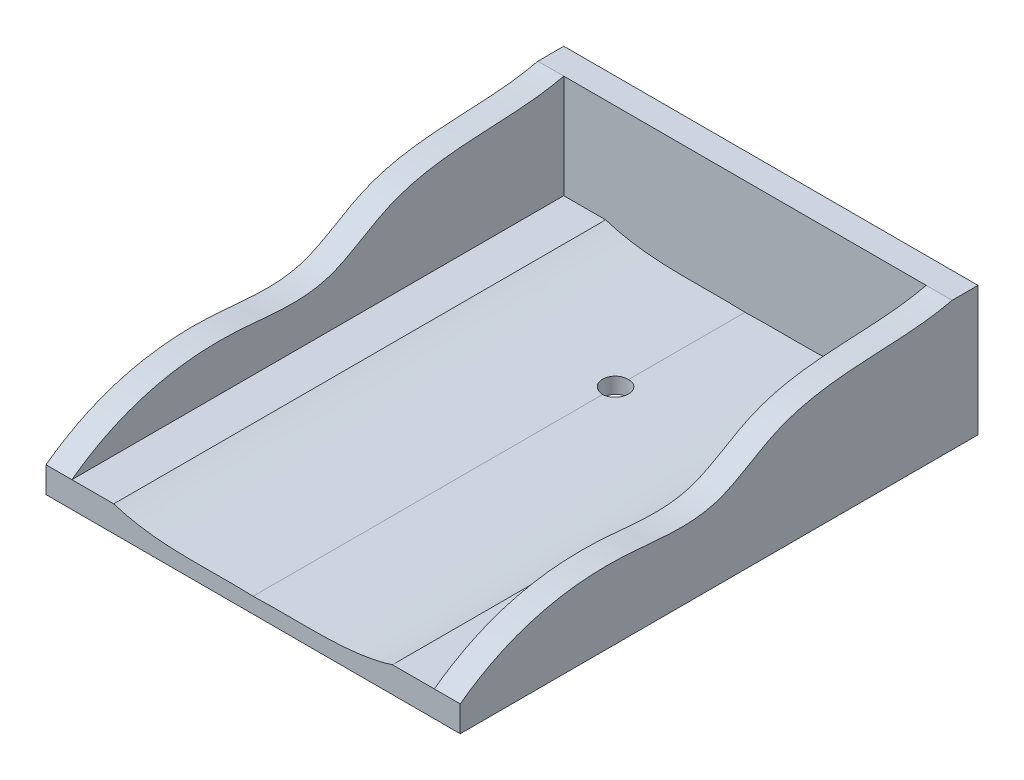
from build123d import *

# Parameters (mm, degrees)
CROQUIS2_W              = 160
CROQUIS2_H              = 200
SALIENTE_EXTRUIR1_DEPTH = 10
CORTAR_EXTRUIR1_DEPTH   = 216.638586528
SALIENTE_EXTRUIR2_DEPTH = 10
SALIENTE_EXTRUIR3_DEPTH = 10
CROQUIS6_R              = 5
CORTAR_EXTRUIR2_DEPTH   = 138.477271016


with BuildPart() as part:
    # Croquis2 → Saliente-Extruir1 (new body)
    with BuildSketch(Plane(origin=(0, 0, 0), x_dir=(1, 0, 0), z_dir=(0, 1, 0))):
        Rectangle(CROQUIS2_W, CROQUIS2_H)
    extrude(amount=SALIENTE_EXTRUIR1_DEPTH)

    # Croquis3 → Cortar-Extruir1 (cut, through all)
    with BuildSketch(Plane.XY.offset(100)):
        with BuildLine():
            Line((-53.826836436, 10), (53.826836436, 10))
            add(Edge.make_bspline(
                [(53.826836436, 10), (36.473349227, 4.426622659), (17.82847287, 6.792306247), (0, 5.99040599)],
                knots=[0, 0, 0, 0, 1, 1, 1, 1], degree=3))
            add(Edge.make_bspline(
                [(-53.826836436, 10), (-36.473349227, 4.426622659), (-17.82847287, 6.792306247), (0, 5.99040599)],
                knots=[0, 0, 0, 0, 1, 1, 1, 1], degree=3))
        make_face()
    extrude(amount=-CORTAR_EXTRUIR1_DEPTH, mode=Mode.SUBTRACT)

    # Croquis4 → Saliente-Extruir2 (add)
    with BuildSketch(Plane(origin=(0, 0, -100), x_dir=(-1, 0, 0), z_dir=(0, 0, -1))):
        Polygon((-80, 10), (-80, 50), (80, 50), (80, 10), (80, 0), (-80, 0), align=None)
    extrude(amount=-SALIENTE_EXTRUIR2_DEPTH)

    # Croquis5 → Saliente-Extruir3 (add)
    with BuildSketch(Plane(origin=(80, 0, 0), x_dir=(0, 0, -1), z_dir=(1, 0, 0))):
        with BuildLine():
            Line((-100, 10), (90, 10))
            Line((90, 10), (90, 50))
            add(Edge.make_bspline(
                [(-100, 10), (-81.144129562, 23.909799652), (-47.883162984, 31.722955742), (-3.174822516, 22.923773002), (33.108941454, 51.133009448), (68.371145219, 44.780803963), (90, 50)],
                knots=[0, 0, 0, 0, 0.338396357, 0.520485989, 0.646796106, 1, 1, 1, 1], degree=3))
        make_face()
    saliente_extruir3 = extrude(amount=-SALIENTE_EXTRUIR3_DEPTH)

    # Simetría1: Saliente-Extruir3 across plane
    add(saliente_extruir3.mirror(Plane(origin=(0, 0, 0), x_dir=(0, 0, 1), z_dir=(1, 0, 0))))

    # Croquis6 → Cortar-Extruir2 (cut, through all)
    with BuildSketch(Plane.XZ):
        with Locations(Location((0, -40, 0), (0, 0, 270))):
            Circle(CROQUIS6_R)
    extrude(amount=-CORTAR_EXTRUIR2_DEPTH, mode=Mode.SUBTRACT)


solid = part.part
